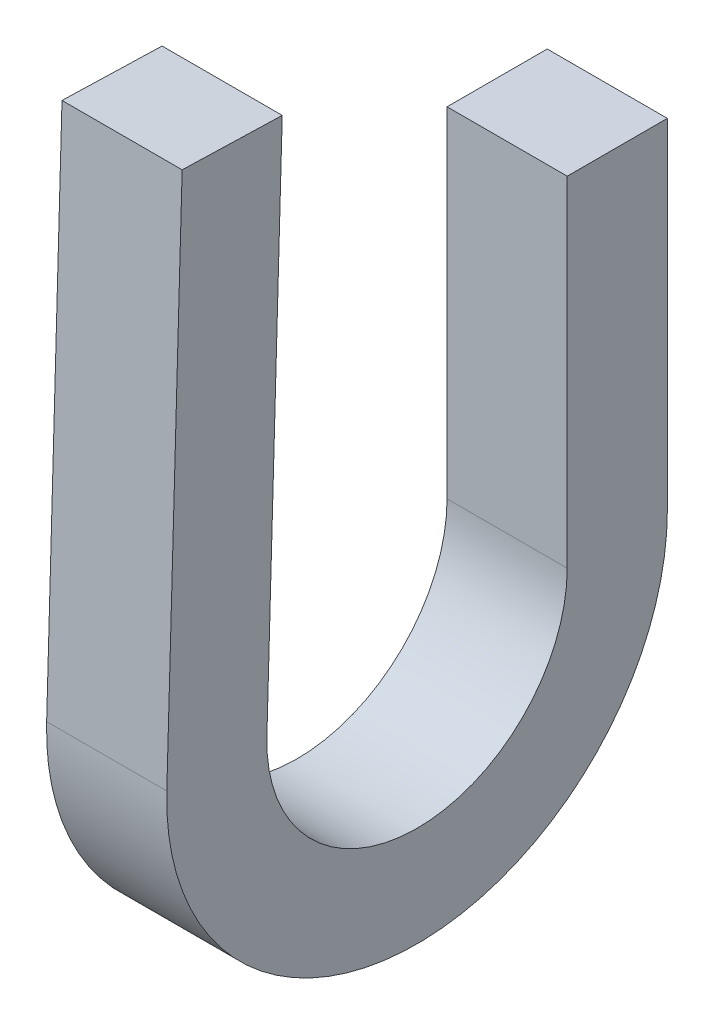
from build123d import *

# Parameters (mm, degrees)
ESQUISSE1_W = 12
ESQUISSE1_H = 10


with BuildPart() as part:
    # Balayage1: sweep along a path in Esquisse2
    with BuildLine(Plane(origin=(0, 0, 0), x_dir=(0, 0, -1), z_dir=(1, 0, 0))) as balayage1_path:
        Line((0, 0), (0, -33.906492139))
        ThreePointArc((0, -33.906492139), (-20.289478653, -53.904397082), (-39.991620211, -33.32759548))
        Line((-39.991620211, -33.32759548), (-38.458045468, 19.632882602))
    # Esquisse1 → Balayage1 (sweep)
    with BuildSketch(Plane(origin=(0, 0, 0), x_dir=(1, 0, 0), z_dir=(0, 1, 0))):
        Rectangle(ESQUISSE1_W, ESQUISSE1_H)
    sweep(path=balayage1_path.line)


solid = part.part
